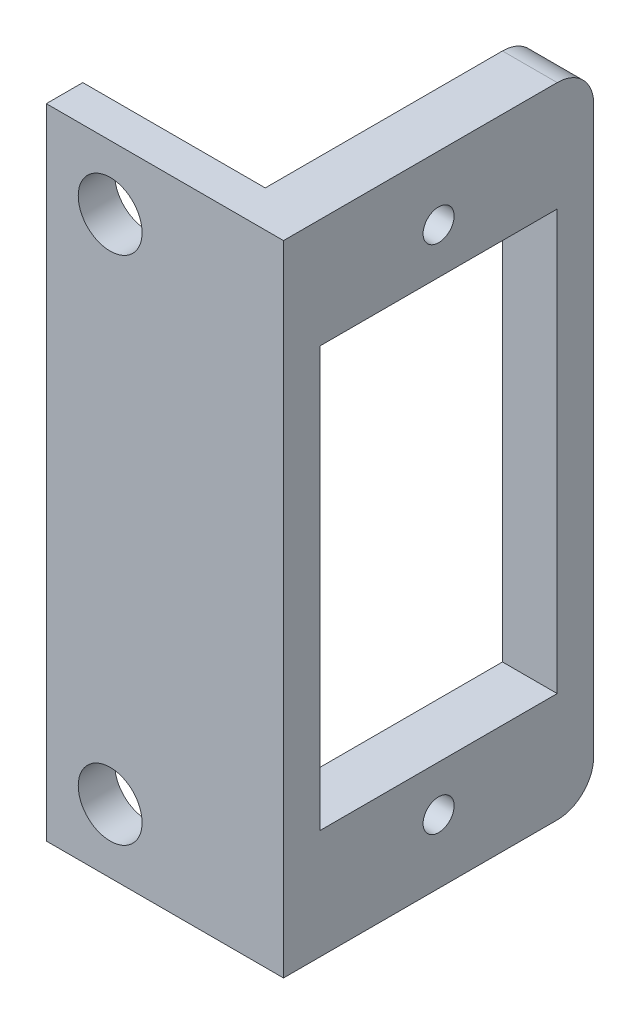
from build123d import *

# Parameters (mm, degrees)
ESBO_O1_W                = 17
ESBO_O1_H                = 35
RESSALTO_EXTRUS_O1_DEPTH = 1.5
CORTE_EXTRUS_O1_REACH    = 21.685
ESBO_O2_W                = 13
ESBO_O2_H                = 23
CORTE_EXTRUS_O2_REACH    = 21.685
ESBO_O3_R                = 0.85
FILETE1_R                = 2
ESBO_O5_W                = 13
ESBO_O5_H                = 35
RESSALTO_EXTRUS_O2_DEPTH = 2
CORTE_EXTRUS_O3_REACH    = 27.758
ESBO_O6_R                = 1.75


with BuildPart() as part:
    # Esboço1 → Ressalto-extrusão1 (new, symmetric)
    with BuildSketch(Plane(origin=(0, 0, 0), x_dir=(0, 0, -1), z_dir=(1, 0, 0))):
        Rectangle(ESBO_O1_W, ESBO_O1_H)
    extrude(amount=RESSALTO_EXTRUS_O1_DEPTH, both=True)

    # Esboço2 → Corte-extrusão1 (cut, up to next)
    with BuildSketch(Plane(origin=(1.5, 0, 0), x_dir=(0, 0, -1), z_dir=(1, 0, 0)), mode=Mode.PRIVATE) as corte_extrus_o1_sk1:
        Rectangle(ESBO_O2_W, ESBO_O2_H)
    corte_extrus_o1_tool1 = extrude(corte_extrus_o1_sk1.sketch, amount=-CORTE_EXTRUS_O1_REACH, mode=Mode.PRIVATE) & part.part
    add(corte_extrus_o1_tool1.solids().sort_by_distance((1.5, 0, 0))[0], mode=Mode.SUBTRACT)

    # Esboço3 → Corte-extrusão2 (cut, up to next)
    with BuildSketch(Plane.ZY.offset(1.5), mode=Mode.PRIVATE) as corte_extrus_o2_sk1:
        with Locations((0, 14)):
            Circle(ESBO_O3_R)
    corte_extrus_o2_tool1 = extrude(corte_extrus_o2_sk1.sketch, amount=-CORTE_EXTRUS_O2_REACH, mode=Mode.PRIVATE) & part.part
    # Esboço3 → Corte-extrusão2 (cut, up to next)
    with BuildSketch(Plane.ZY.offset(1.5), mode=Mode.PRIVATE) as corte_extrus_o2_sk2:
        with Locations((0, -14)):
            Circle(ESBO_O3_R)
    corte_extrus_o2_tool2 = extrude(corte_extrus_o2_sk2.sketch, amount=-CORTE_EXTRUS_O2_REACH, mode=Mode.PRIVATE) & part.part
    add(corte_extrus_o2_tool1.solids().sort_by_distance((-1.5, 14, 0))[0], mode=Mode.SUBTRACT)
    add(corte_extrus_o2_tool2.solids().sort_by_distance((-1.5, -14, 0))[0], mode=Mode.SUBTRACT)

    # Filete1
    filete1_edges = [part.edges().sort_by_distance(p)[0] for p in [
        (0, -17.5, -8.5),
        (0, 17.5, -8.5),
    ]]
    fillet(filete1_edges, radius=FILETE1_R)

    # Esboço5 → Ressalto-extrusão2 (add)
    with BuildSketch(Plane.XY.offset(8.5)):
        with Locations((-5, 0)):
            Rectangle(ESBO_O5_W, ESBO_O5_H)
    extrude(amount=-RESSALTO_EXTRUS_O2_DEPTH)

    # Esboço6 → Corte-extrusão3 (cut, up to next)
    with BuildSketch(Plane.XY.offset(6.5), mode=Mode.PRIVATE) as corte_extrus_o3_sk1:
        with Locations(Location((-8, 14, 0), (0, 0, 180))):
            Circle(ESBO_O6_R)
    corte_extrus_o3_tool1 = extrude(corte_extrus_o3_sk1.sketch, amount=CORTE_EXTRUS_O3_REACH, mode=Mode.PRIVATE) & part.part
    # Esboço6 → Corte-extrusão3 (cut, up to next)
    with BuildSketch(Plane.XY.offset(6.5), mode=Mode.PRIVATE) as corte_extrus_o3_sk2:
        with Locations(Location((-8, -14, 0), (0, 0, 180))):
            Circle(ESBO_O6_R)
    corte_extrus_o3_tool2 = extrude(corte_extrus_o3_sk2.sketch, amount=CORTE_EXTRUS_O3_REACH, mode=Mode.PRIVATE) & part.part
    add(corte_extrus_o3_tool1.solids().sort_by_distance((-8, 14, 6.5))[0], mode=Mode.SUBTRACT)
    add(corte_extrus_o3_tool2.solids().sort_by_distance((-8, -14, 6.5))[0], mode=Mode.SUBTRACT)


solid = part.part
